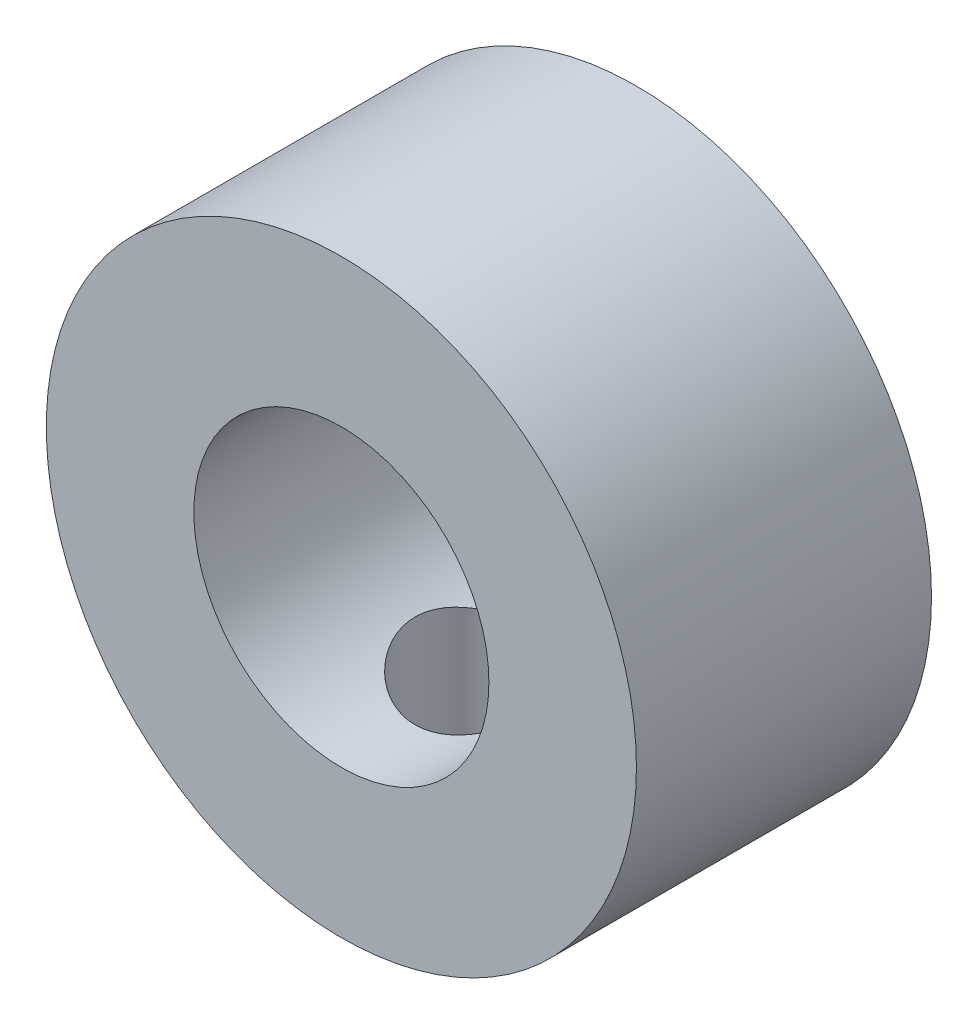
from build123d import *

# Parameters (mm, degrees)
SKETCH1_R           = 5
SKETCH1_R_2         = 2.5
BOSS_EXTRUDE1_DEPTH = 5
SKETCH2_R           = 1.25
CUT_EXTRUDE1_DEPTH  = 9.660254038


with BuildPart() as part:
    # Sketch1 → Boss-Extrude1 (new body)
    with BuildSketch(Plane.XY):
        Circle(SKETCH1_R)
        Circle(SKETCH1_R_2, mode=Mode.SUBTRACT)
    extrude(amount=BOSS_EXTRUDE1_DEPTH)

    # Sketch2 → Cut-Extrude1 (cut, through all)
    with BuildSketch(Plane(origin=(0, 0, 0), x_dir=(1, 0, 0), z_dir=(0, 1, 0))):
        with Locations(Location((0, -2.5, 0), (0, 0, 270))):
            Circle(SKETCH2_R)
    extrude(amount=-CUT_EXTRUDE1_DEPTH, mode=Mode.SUBTRACT)


solid = part.part
